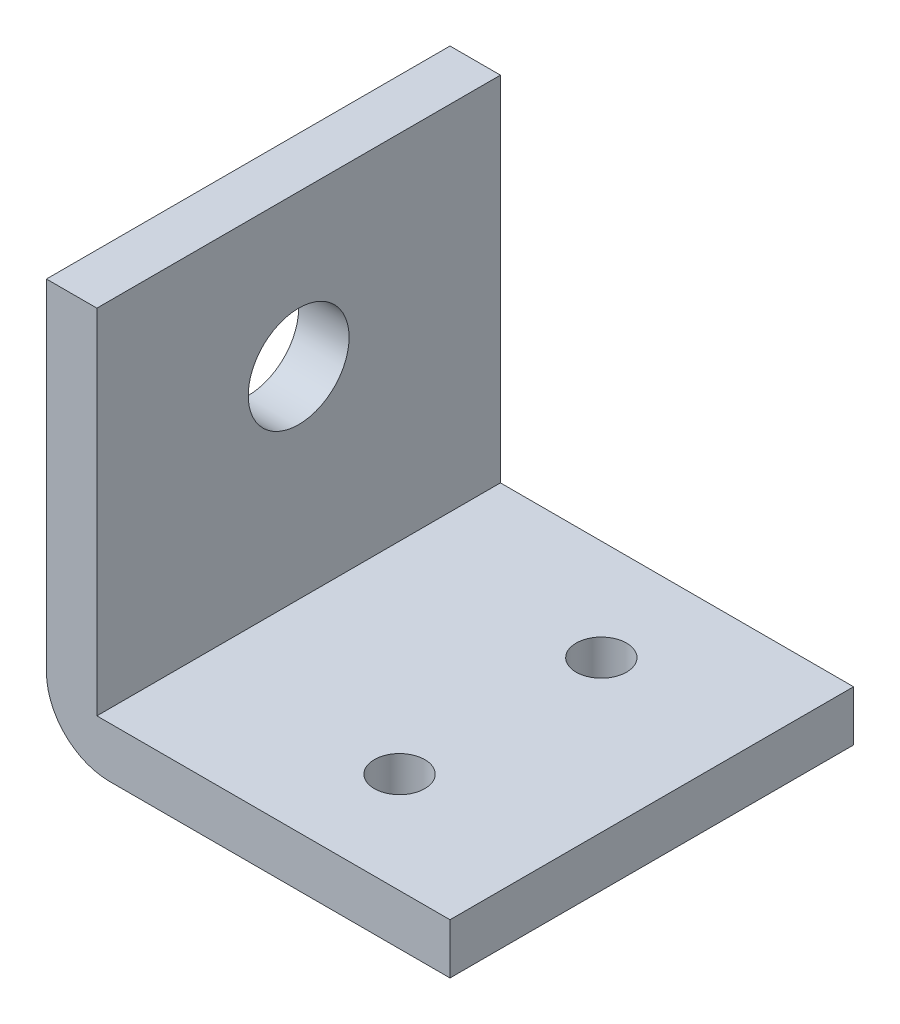
from build123d import *

# Parameters (mm, degrees)
BOSS_EXTRUDE6_DEPTH = 40
SKETCH6_R           = 5
CUT_EXTRUDE1_DEPTH  = 64.639610307
SKETCH7_R           = 2.5
CUT_EXTRUDE2_DEPTH  = 67.520673478


with BuildPart() as part:
    # Sketch1 → Boss-Extrude6 (new body)
    with BuildSketch(Plane.XY):
        with BuildLine():
            Line((-35, 35), (-35, 0))
            Line((-35, 0), (0, 0))
            Line((0, 0), (0, -5))
            Line((0, -5), (-33.75, -5))
            ThreePointArc((-33.75, -5), (-38.169417382, -3.169417382), (-40, 1.25))
            Line((-40, 1.25), (-40, 35))
            Line((-40, 35), (-35, 35))
        make_face()
    extrude(amount=BOSS_EXTRUDE6_DEPTH)

    # Sketch6 → Cut-Extrude1 (cut, through all)
    with BuildSketch(Plane(origin=(-35, 0, 0), x_dir=(0, 0, -1), z_dir=(1, 0, 0))):
        with Locations((-20, 20)):
            Circle(SKETCH6_R)
    extrude(amount=-CUT_EXTRUDE1_DEPTH, mode=Mode.SUBTRACT)

    # Sketch7 → Cut-Extrude2 (cut, through all)
    with BuildSketch(Plane(origin=(0, 0, 0), x_dir=(1, 0, 0), z_dir=(0, 1, 0))):
        with Locations(Location((-15, -10, 0), (0, 0, 270))):
            Circle(SKETCH7_R)
        with Locations(Location((-15, -30, 0), (0, 0, 270))):
            Circle(SKETCH7_R)
    extrude(amount=-CUT_EXTRUDE2_DEPTH, mode=Mode.SUBTRACT)


solid = part.part
